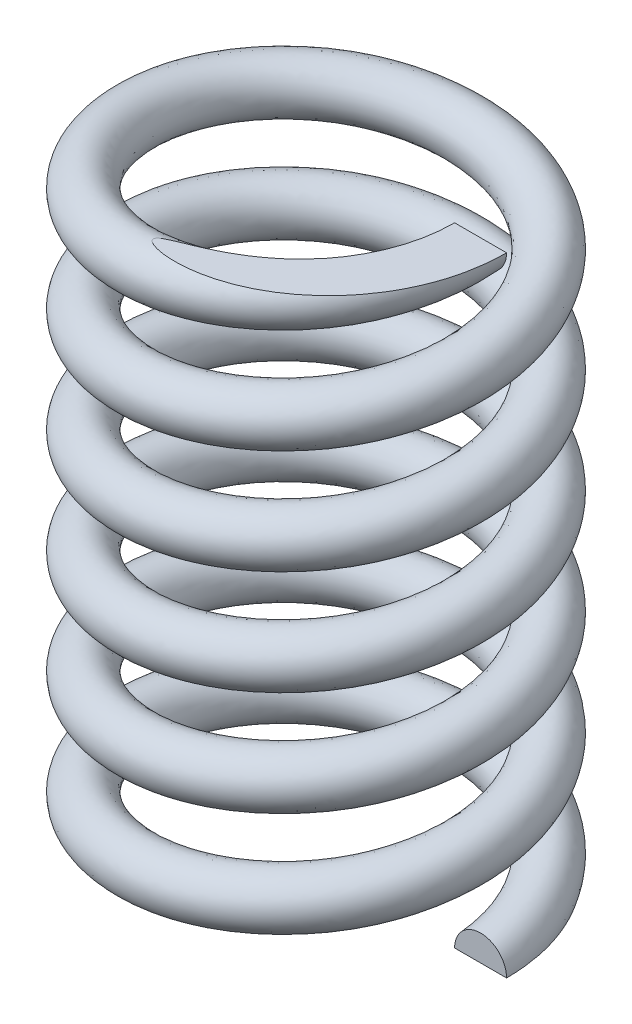
from build123d import *

# Parameters (mm, degrees)
SWEEP_1_PITCH            = 1.208333333
SWEEP_1_HEIGHT           = 7.25
SWEEP_1_RADIUS           = 1.9
SWEEP_1_START_ANGLE      = 90
SKETCH_2_R               = 0.3
CUT_EXTRUDE_1_DEPTH      = 9.165939048
CUT_EXTRUDE_1_DEPTH_BACK = 9.165939048
SKETCH_3_OUTSIDE_W       = 8.404
SKETCH_3_OUTSIDE_H       = 11.854
SKETCH_3_OUTSIDE_W_2     = 34.401094542
SKETCH_3_OUTSIDE_H_2     = 7.25


with BuildPart() as part:
    # По траектории1: sweep along a helix
    with BuildLine() as sweep_1_path:
        add(Helix(SWEEP_1_PITCH, SWEEP_1_HEIGHT, SWEEP_1_RADIUS, center=(0, 0, 0), direction=(0, 1, 0), mode=Mode.PRIVATE).rotate(Axis((0, 0, 0), (0, 1, 0)), SWEEP_1_START_ANGLE))
    # Эскиз2 → По траектории1 (sweep)
    with BuildSketch(Plane.XY):
        with Locations((1.9, 0)):
            Circle(SKETCH_2_R)
    sweep(path=sweep_1_path.line, is_frenet=True)

    # Эскиз3 outside → Вырез-Вытянуть1 (cut, two sides: drawn at the far end of the back side and taken through both)
    with BuildSketch(Plane.XY.offset(-CUT_EXTRUDE_1_DEPTH_BACK)):
        with Locations((0, 3.625)):
            Rectangle(SKETCH_3_OUTSIDE_W, SKETCH_3_OUTSIDE_H)
        with Locations((0, 3.625)):
            Rectangle(SKETCH_3_OUTSIDE_W_2, SKETCH_3_OUTSIDE_H_2, mode=Mode.SUBTRACT)
    extrude(amount=CUT_EXTRUDE_1_DEPTH + CUT_EXTRUDE_1_DEPTH_BACK, mode=Mode.SUBTRACT)


solid = part.part
